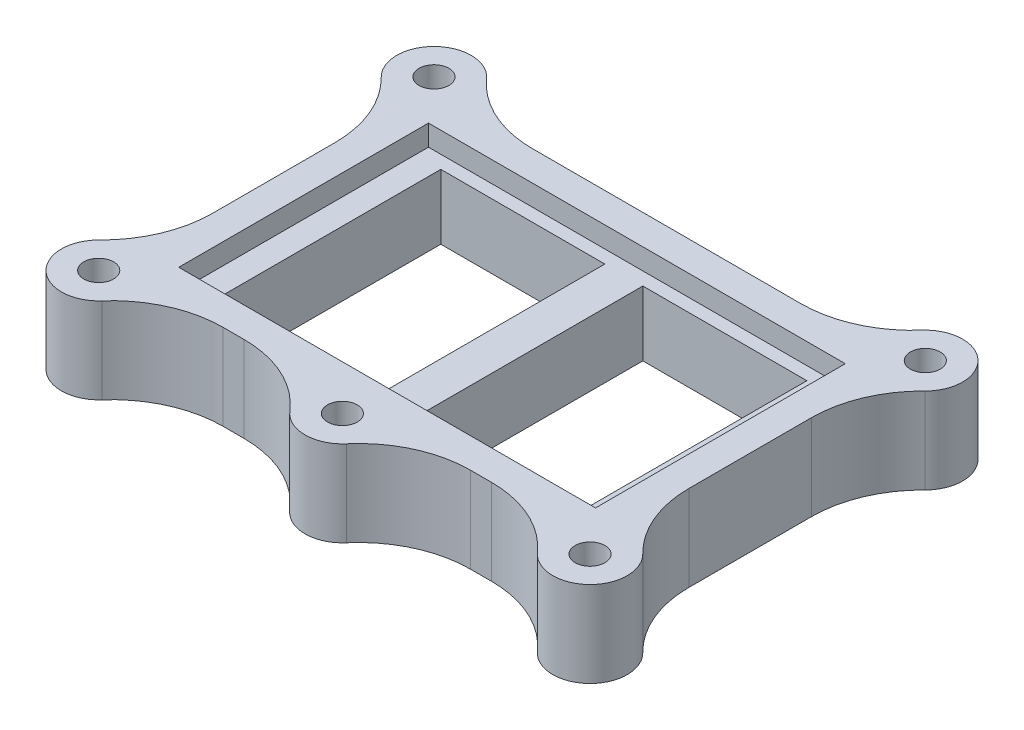
from build123d import *

# Parameters (mm, degrees)
SKETCH1_W           = 22
SKETCH1_H           = 30
BOSS_EXTRUDE1_DEPTH = 8.7
SKETCH2_W           = 63.9
SKETCH2_H           = 41.5
SKETCH2_W_2         = 55.9
SKETCH2_H_2         = 33.5
BOSS_EXTRUDE2_DEPTH = 11.5
SKETCH3_R           = 5
SKETCH3_R_2         = 2
BOSS_EXTRUDE3_DEPTH = 8.5
SKETCH4_R           = 5
BOSS_EXTRUDE4_DEPTH = 3
FILLET2_R           = 15


with BuildPart() as part:
    # Sketch1 → Boss-Extrude1 (new body)
    with BuildSketch(Plane(origin=(0, 0, 0), x_dir=(1, 0, 0), z_dir=(0, 1, 0))):
        Polygon((-26.45, -16.75), (26.45, -16.75), (27.95, -16.75), (27.95, 16.75), (26.45, 16.75), (-26.45, 16.75), (-27.95, 16.75), (-27.95, -16.75), align=None)
        with Locations((-13.55, 0)):
            Rectangle(SKETCH1_W, SKETCH1_H, mode=Mode.SUBTRACT)
        with Locations((13.55, 0)):
            Rectangle(SKETCH1_W, SKETCH1_H, mode=Mode.SUBTRACT)
    extrude(amount=BOSS_EXTRUDE1_DEPTH)

    # Sketch2 → Boss-Extrude2 (add)
    with BuildSketch(Plane.XZ):
        Rectangle(SKETCH2_W, SKETCH2_H)
        Rectangle(SKETCH2_W_2, SKETCH2_H_2, mode=Mode.SUBTRACT)
    extrude(amount=-BOSS_EXTRUDE2_DEPTH)

    # Sketch3 → Boss-Extrude3 (add)
    # profile 1 of 5: a face of its own
    with BuildSketch(Plane(origin=(0, 11.5, 0), x_dir=(1, 0, 0), z_dir=(0, 1, 0))):
        with Locations((-32.95, 22.482050808)):
            Circle(SKETCH3_R)
        with Locations(Location((-32.95, 22.482050808, 0), (0, 0, 270))):
            Circle(SKETCH3_R_2, mode=Mode.SUBTRACT)
    # profile 2 of 5: a face of its own
    with BuildSketch(Plane(origin=(0, 11.5, 0), x_dir=(1, 0, 0), z_dir=(0, 1, 0))):
        with Locations((-32.95, -22.482050808)):
            Circle(SKETCH3_R)
        with Locations(Location((-32.95, -22.482050808, 0), (0, 0, 270))):
            Circle(SKETCH3_R_2, mode=Mode.SUBTRACT)
    # profile 3 of 5: a face of its own
    with BuildSketch(Plane(origin=(0, 11.5, 0), x_dir=(1, 0, 0), z_dir=(0, 1, 0))):
        with Locations((32.95, -22.482050808)):
            Circle(SKETCH3_R)
        with Locations(Location((32.95, -22.482050808, 0), (0, 0, 270))):
            Circle(SKETCH3_R_2, mode=Mode.SUBTRACT)
    # profile 4 of 5: a face of its own
    with BuildSketch(Plane(origin=(0, 11.5, 0), x_dir=(1, 0, 0), z_dir=(0, 1, 0))):
        with Locations((32.95, 22.482050808)):
            Circle(SKETCH3_R)
        with Locations(Location((32.95, 22.482050808, 0), (0, 0, 270))):
            Circle(SKETCH3_R_2, mode=Mode.SUBTRACT)
    # profile 5 of 5: a face of its own
    with BuildSketch(Plane(origin=(0, 11.5, 0), x_dir=(1, 0, 0), z_dir=(0, 1, 0))):
        with Locations((0, -22.75)):
            Circle(SKETCH3_R)
        with Locations(Location((0, -22.75, 0), (0, 0, 270))):
            Circle(SKETCH3_R_2, mode=Mode.SUBTRACT)
    extrude(amount=-BOSS_EXTRUDE3_DEPTH)

    # Sketch4 → Boss-Extrude4 (add)
    with BuildSketch(Plane.XZ.offset(-3)):
        with Locations((-32.95, -22.482050808)):
            Circle(SKETCH4_R)
        with Locations((-32.95, 22.482050808)):
            Circle(SKETCH4_R)
        with Locations((0, 22.75)):
            Circle(SKETCH4_R)
        with Locations((32.95, 22.482050808)):
            Circle(SKETCH4_R)
        with Locations((32.95, -22.482050808)):
            Circle(SKETCH4_R)
    extrude(amount=BOSS_EXTRUDE4_DEPTH)

    # Fillet2
    fillet2_edges = [part.edges().sort_by_distance(p)[0] for p in [
        (28.25958424, 5.75, 20.75),
        (31.95, 5.75, 17.583071322),
        (31.95, 5.75, -17.583071322),
        (28.25958424, 5.75, -20.75),
        (4.582575695, 5.75, 20.75),
        (-4.582575695, 5.75, 20.75),
        (-28.25958424, 5.75, -20.75),
        (-31.95, 5.75, -17.583071322),
        (-28.25958424, 5.75, 20.75),
        (-31.95, 5.75, 17.583071322),
    ]]
    fillet(fillet2_edges, radius=FILLET2_R)


solid = part.part
